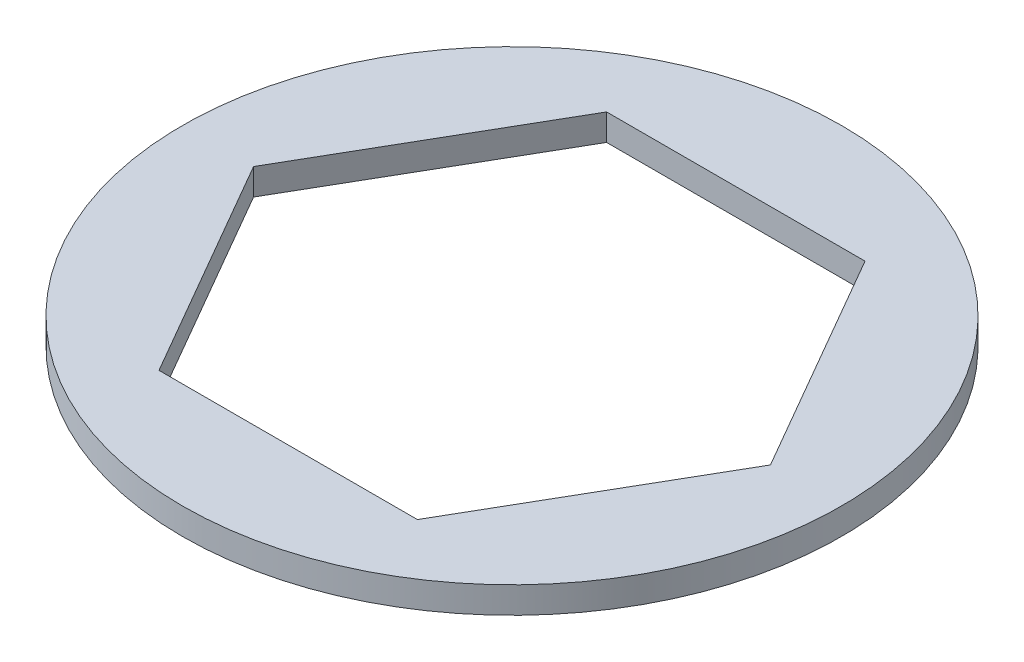
from build123d import *

# Parameters (mm, degrees)
SKETCH1_R           = 9.5
BOSS_EXTRUDE1_DEPTH = 0.762


with BuildPart() as part:
    # Sketch1 → Boss-Extrude1 (new body)
    with BuildSketch(Plane(origin=(0, 0, 0), x_dir=(1, 0, 0), z_dir=(0, 1, 0))):
        with Locations(Location((0, 0, 0), (0, 0, 270))):
            Circle(SKETCH1_R)
        Polygon((7.449665993, 0), (3.724832997, 6.4516), (-3.724832997, 6.4516), (-7.449665993, 0), (-3.724832997, -6.4516), (3.724832997, -6.4516), align=None, mode=Mode.SUBTRACT)
    extrude(amount=-BOSS_EXTRUDE1_DEPTH)


solid = part.part
